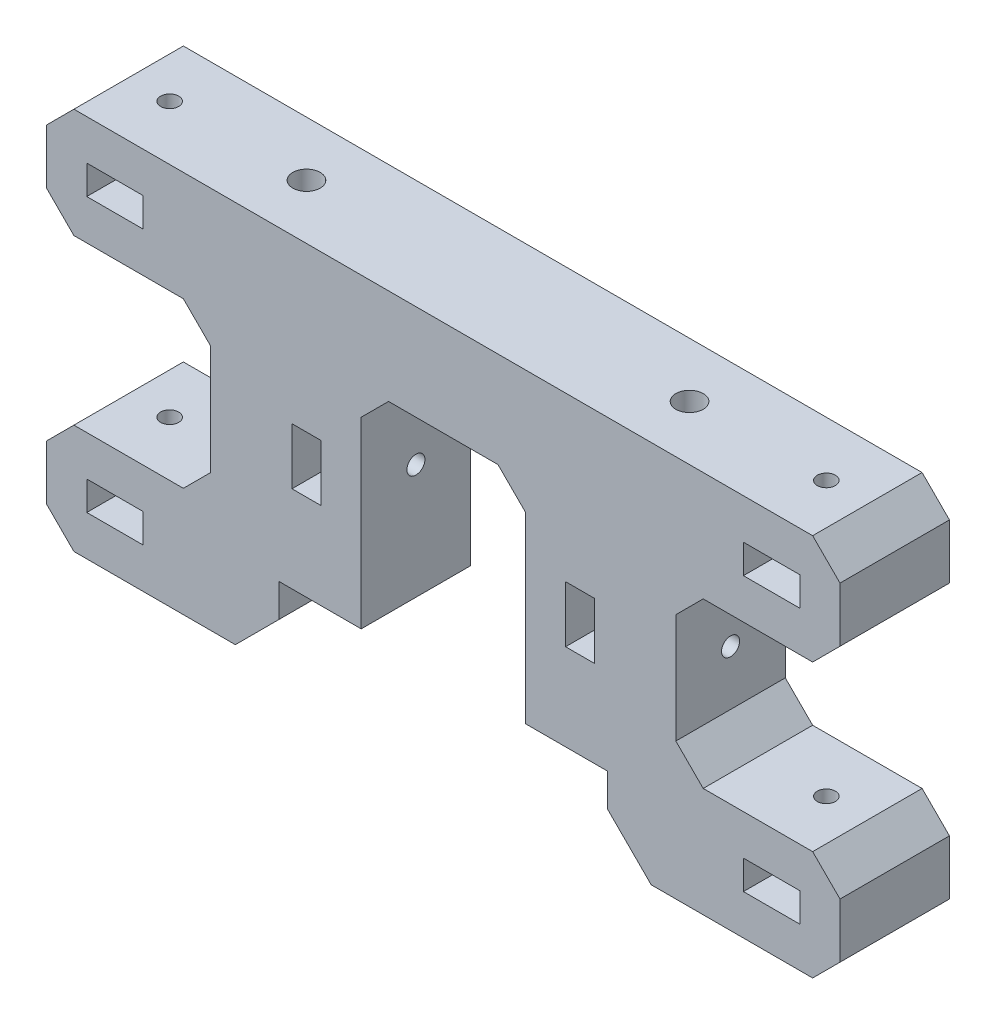
from build123d import *

# Parameters (mm, degrees)
SKETCH_1_W               = 10.3
SKETCH_1_H               = 5.3
SKETCH_1_W_2             = 5.3
SKETCH_1_H_2             = 10.3
EXTRUDE_2_DEPTH          = 20
CHAMFER_1_SIZE           = 5
CUT_EXTRUDE_1_REACH      = 104.744
SKETCH_2_R               = 1.65
CUT_EXTRUDE_2_REACH      = 123.861
SKETCH_4_R               = 1.65
MIRROR_2_COPY_1_REACH    = 104.744
MIRROR_2_COPY_1_SKETCH_R = 1.65
SKETCH_7_R               = 2.5
CUT_EXTRUDE_4_DEPTH      = 15
CUT_EXTRUDE_7_REACH      = 84.953
SKETCH_11_R              = 2.5
CUT_EXTRUDE_8_DEPTH      = 10


with BuildPart() as part:
    # 草圖1 → 填料-伸長2 (new body)
    with BuildSketch(Plane.XY):
        Polygon((15, 17.5), (15, -35), (72.5, -35), (72.5, -15), (42.5, -15), (42.5, 15), (72.5, 15), (72.5, 35), (-72.5, 35), (-72.5, 15), (-42.5, 15), (-42.5, -15), (-72.5, -15), (-72.5, -35), (-15, -35), (-15, 17.5), align=None)
        with Locations((-60, -25)):
            Rectangle(SKETCH_1_W, SKETCH_1_H, mode=Mode.SUBTRACT)
        with Locations((-60, 25)):
            Rectangle(SKETCH_1_W, SKETCH_1_H, mode=Mode.SUBTRACT)
        with Locations((-25, 0)):
            Rectangle(SKETCH_1_W_2, SKETCH_1_H_2, mode=Mode.SUBTRACT)
        with Locations((60, -25)):
            Rectangle(SKETCH_1_W, SKETCH_1_H, mode=Mode.SUBTRACT)
        with Locations((25, 0)):
            Rectangle(SKETCH_1_W_2, SKETCH_1_H_2, mode=Mode.SUBTRACT)
        with Locations((60, 25)):
            Rectangle(SKETCH_1_W, SKETCH_1_H, mode=Mode.SUBTRACT)
    extrude(amount=EXTRUDE_2_DEPTH)

    # 導角1
    chamfer_1_edges = [part.edges().sort_by_distance(p)[0] for p in [
        (-15, 17.5, 10),
        (-72.5, -35, 10),
        (-72.5, -15, 10),
        (-42.5, -15, 10),
        (-42.5, 15, 10),
        (-72.5, 15, 10),
        (-72.5, 35, 10),
        (72.5, 35, 10),
        (72.5, 15, 10),
        (42.5, 15, 10),
        (42.5, -15, 10),
        (72.5, -15, 10),
        (72.5, -35, 10),
        (15, 17.5, 10),
    ]]
    chamfer(chamfer_1_edges, length=CHAMFER_1_SIZE)

    # 除料-伸長1: up to this face of the body (flat: up to its plane)
    cut_extrude_1_end = Plane(part.part.faces().sort_by_distance((57.5, 15, 10))[0])
    # 草圖2 → 除料-伸長1 (cut, up to the picked face)
    with BuildSketch(Plane(origin=(0, 35, 0), x_dir=(1, 0, 0), z_dir=(0, 1, 0)), mode=Mode.PRIVATE) as cut_extrude_1_sk1:
        with Locations(Location((60, -10, 0), (0, 0, 270))):
            Circle(SKETCH_2_R)
    cut_extrude_1_tool1 = split(extrude(cut_extrude_1_sk1.sketch, amount=-CUT_EXTRUDE_1_REACH, mode=Mode.PRIVATE), bisect_by=cut_extrude_1_end, keep=Keep.BOTH, mode=Mode.PRIVATE)
    cut_extrude_1 = cut_extrude_1_tool1.solids().sort_by(Axis((60, 35, 10), (0, -1, 0)))[0]
    add(cut_extrude_1, mode=Mode.SUBTRACT)

    # 除料-伸長2: up to this face of the body (flat: up to its plane)
    cut_extrude_2_end = Plane(part.part.faces().sort_by_distance((15, -11.25, 10))[0])
    # 草圖4 → 除料-伸長2 (cut, up to the picked face)
    with BuildSketch(Plane(origin=(42.5, 0, 0), x_dir=(0, 0, -1), z_dir=(1, 0, 0)), mode=Mode.PRIVATE) as cut_extrude_2_sk1:
        with Locations((-10, 0)):
            Circle(SKETCH_4_R)
    cut_extrude_2_tool1 = split(extrude(cut_extrude_2_sk1.sketch, amount=-CUT_EXTRUDE_2_REACH, mode=Mode.PRIVATE), bisect_by=cut_extrude_2_end, keep=Keep.BOTH, mode=Mode.PRIVATE)
    cut_extrude_2 = cut_extrude_2_tool1.solids().sort_by(Axis((42.5, 0, 10), (-1, 0, 0)))[0]
    add(cut_extrude_2, mode=Mode.SUBTRACT)

    # 鏡射1: 除料-伸長1 across plane
    add(cut_extrude_1.mirror(Plane.ZX), mode=Mode.SUBTRACT)

    # 鏡射2: 除料-伸長1, 除料-伸長2 across plane
    add(cut_extrude_1.mirror(Plane(origin=(0, 0, 0), x_dir=(0, 0, 1), z_dir=(1, 0, 0))), mode=Mode.SUBTRACT)
    add(cut_extrude_2.mirror(Plane(origin=(0, 0, 0), x_dir=(0, 0, 1), z_dir=(1, 0, 0))), mode=Mode.SUBTRACT)

    # 鏡射2 copy 1: up to this face of the body (flat: up to its plane)
    mirror_2_copy_1_end = Plane(part.part.faces().sort_by_distance((-57.5, -15, 10))[0])
    # 鏡射2 copy 1 sketch → 鏡射2 copy 1 (cut, up to the picked face)
    with BuildSketch(Plane(origin=(0, -35, 0), x_dir=(-1, 0, 0), z_dir=(0, -1, 0)), mode=Mode.PRIVATE) as mirror_2_copy_1_sk1:
        with Locations(Location((60, -10, 0), (0, 0, 270))):
            Circle(MIRROR_2_COPY_1_SKETCH_R)
    mirror_2_copy_1_tool1 = split(extrude(mirror_2_copy_1_sk1.sketch, amount=-MIRROR_2_COPY_1_REACH, mode=Mode.PRIVATE), bisect_by=mirror_2_copy_1_end, keep=Keep.BOTH, mode=Mode.PRIVATE)
    add(mirror_2_copy_1_tool1.solids().sort_by(Axis((-60, -35, 10), (0, 1, 0)))[0], mode=Mode.SUBTRACT)

    # 草圖7 → 除料-伸長4 (cut)
    with BuildSketch(Plane(origin=(0, 35, 0), x_dir=(1, 0, 0), z_dir=(0, 1, 0))):
        with Locations(Location((35, -10, 0), (0, 0, 270))):
            Circle(SKETCH_7_R)
    cut_extrude_4 = extrude(amount=-CUT_EXTRUDE_4_DEPTH, mode=Mode.SUBTRACT)

    # 鏡射9: 除料-伸長4 across plane
    add(cut_extrude_4.mirror(Plane(origin=(0, 0, 0), x_dir=(0, 0, 1), z_dir=(1, 0, 0))), mode=Mode.SUBTRACT)

    # 草圖10 → 除料-伸長7 (cut, up to next)
    with BuildSketch(Plane.XY.offset(20), mode=Mode.PRIVATE) as cut_extrude_7_sk1:
        Polygon((15, -35), (15, -21), (30, -21), (30, -27), (38, -35), (30, -35), align=None)
    cut_extrude_7_tool1 = extrude(cut_extrude_7_sk1.sketch, amount=-CUT_EXTRUDE_7_REACH, mode=Mode.PRIVATE) & part.part
    cut_extrude_7 = cut_extrude_7_tool1.solids().sort_by_distance((23.844353, -28.573003, 20))[0]
    add(cut_extrude_7, mode=Mode.SUBTRACT)

    # 草圖11 → 除料-伸長8 (cut)
    with BuildSketch(Plane(origin=(0, -21, 0), x_dir=(-1, 0, 0), z_dir=(0, -1, 0))):
        with Locations(Location((-22.5, -10, 0), (0, 0, 90))):
            Circle(SKETCH_11_R)
    cut_extrude_8 = extrude(amount=-CUT_EXTRUDE_8_DEPTH, mode=Mode.SUBTRACT)

    # 鏡射10: 除料-伸長7, 除料-伸長8 across plane
    add(cut_extrude_7.mirror(Plane(origin=(0, 0, 0), x_dir=(0, 0, 1), z_dir=(1, 0, 0))), mode=Mode.SUBTRACT)
    add(cut_extrude_8.mirror(Plane(origin=(0, 0, 0), x_dir=(0, 0, 1), z_dir=(1, 0, 0))), mode=Mode.SUBTRACT)


solid = part.part
